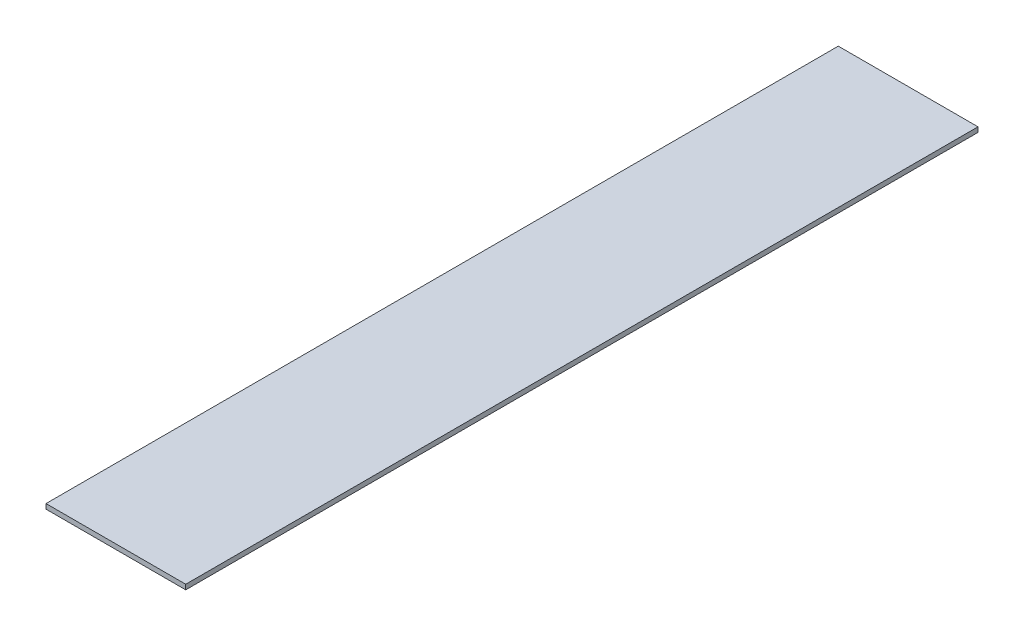
from build123d import *

# Parameters (mm, degrees)
SKETCH2_W           = 128.74
SKETCH2_H           = 730
BOSS_EXTRUDE1_DEPTH = 4.5


with BuildPart() as part:
    # Sketch2 → Boss-Extrude1 (new body)
    with BuildSketch(Plane(origin=(0, 0, 0), x_dir=(1, 0, 0), z_dir=(0, 1, 0))):
        Rectangle(SKETCH2_W, SKETCH2_H)
    extrude(amount=BOSS_EXTRUDE1_DEPTH)


solid = part.part
